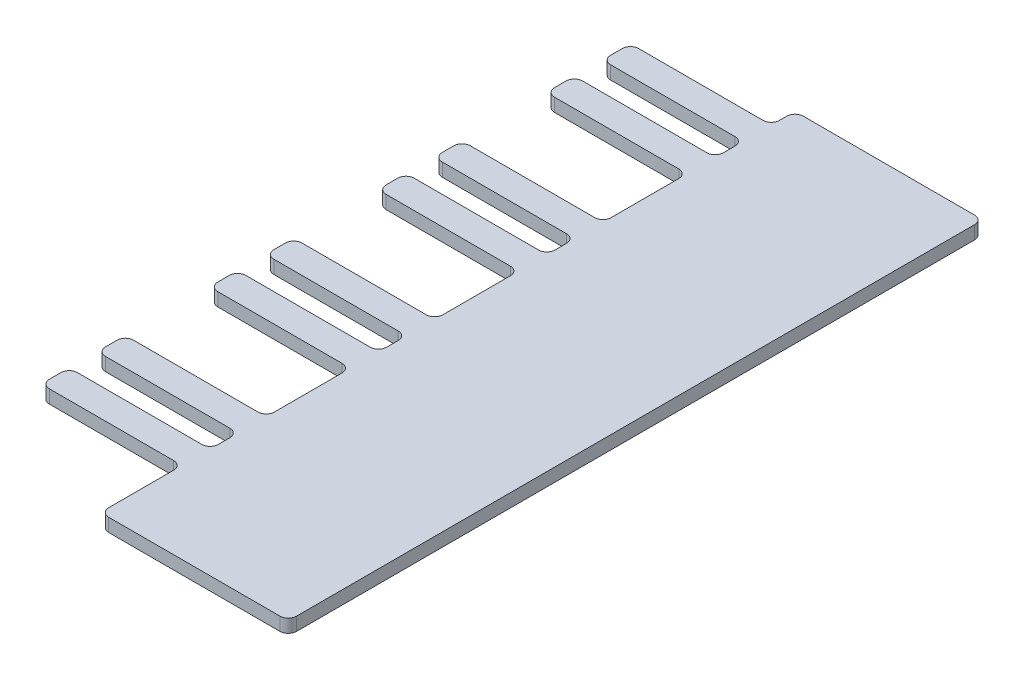
from build123d import *

# Parameters (mm, degrees)
BOSS_EXTRUDE1_DEPTH = 1.2


with BuildPart() as part:
    # Sketch1 → Boss-Extrude1 (new body)
    with BuildSketch(Plane(origin=(0, 0, 0), x_dir=(1, 0, 0), z_dir=(0, 1, 0))):
        with BuildLine():
            Line((-0.75, 7.382), (-12, 7.382))
            ThreePointArc((-12, 7.382), (-12.530330086, 7.601669914), (-12.75, 8.132))
            Line((-12.75, 8.132), (-12.75, 9.172))
            ThreePointArc((-12.75, 9.172), (-12.530330086, 9.702330086), (-12, 9.922))
            Line((-12, 9.922), (-0.75, 9.922))
            ThreePointArc((-0.75, 9.922), (-0.219669914, 10.141669914), (0, 10.672))
            Line((0, 10.672), (0, 11.712))
            ThreePointArc((0, 11.712), (-0.219669914, 12.242330086), (-0.75, 12.462))
            Line((-0.75, 12.462), (-12, 12.462))
            ThreePointArc((-12, 12.462), (-12.530330086, 12.681669914), (-12.75, 13.212))
            Line((-12.75, 13.212), (-12.75, 14.252))
            ThreePointArc((-12.75, 14.252), (-12.530330086, 14.782330086), (-12, 15.002))
            Line((-12, 15.002), (-0.75, 15.002))
            ThreePointArc((-0.75, 15.002), (-0.219669914, 15.221669914), (0, 15.752))
            Line((0, 15.752), (0, 21.872))
            ThreePointArc((0, 21.872), (-0.219669914, 22.402330086), (-0.75, 22.622))
            Line((-0.75, 22.622), (-12, 22.622))
            ThreePointArc((-12, 22.622), (-12.530330086, 22.841669914), (-12.75, 23.372))
            Line((-12.75, 23.372), (-12.75, 24.412))
            ThreePointArc((-12.75, 24.412), (-12.530330086, 24.942330086), (-12, 25.162))
            Line((-12, 25.162), (-0.75, 25.162))
            ThreePointArc((-0.75, 25.162), (-0.219669914, 25.381669914), (0, 25.912))
            Line((0, 25.912), (0, 26.952))
            ThreePointArc((0, 26.952), (-0.219669914, 27.482330086), (-0.75, 27.702))
            Line((-0.75, 27.702), (-12, 27.702))
            ThreePointArc((-12, 27.702), (-12.530330086, 27.921669914), (-12.75, 28.452))
            Line((-12.75, 28.452), (-12.75, 29.492))
            ThreePointArc((-12.75, 29.492), (-12.530330086, 30.022330086), (-12, 30.242))
            Line((-12, 30.242), (-0.75, 30.242))
            ThreePointArc((-0.75, 30.242), (-0.219669914, 30.461669914), (0, 30.992))
            Line((0, 30.992), (0, 37.112))
            ThreePointArc((0, 37.112), (-0.219669914, 37.642330086), (-0.75, 37.862))
            Line((-0.75, 37.862), (-12, 37.862))
            ThreePointArc((-12, 37.862), (-12.530330086, 38.081669914), (-12.75, 38.612))
            Line((-12.75, 38.612), (-12.75, 39.652))
            ThreePointArc((-12.75, 39.652), (-12.530330086, 40.182330086), (-12, 40.402))
            Line((-12, 40.402), (-0.75, 40.402))
            ThreePointArc((-0.75, 40.402), (-0.219669914, 40.621669914), (0, 41.152))
            Line((0, 41.152), (0, 42.192))
            ThreePointArc((0, 42.192), (-0.219669914, 42.722330086), (-0.75, 42.942))
            Line((-0.75, 42.942), (-12, 42.942))
            ThreePointArc((-12, 42.942), (-12.530330086, 43.161669914), (-12.75, 43.692))
            Line((-12.75, 43.692), (-12.75, 44.732))
            ThreePointArc((-12.75, 44.732), (-12.530330086, 45.262330086), (-12, 45.482))
            Line((-12, 45.482), (-0.75, 45.482))
            ThreePointArc((-0.75, 45.482), (-0.219669914, 45.701669914), (0, 46.232))
            Line((0, 46.232), (0, 52.352))
            ThreePointArc((0, 52.352), (-0.219669914, 52.882330086), (-0.75, 53.102))
            Line((-0.75, 53.102), (-12, 53.102))
            ThreePointArc((-12, 53.102), (-12.530330086, 53.321669914), (-12.75, 53.852))
            Line((-12.75, 53.852), (-12.75, 54.892))
            ThreePointArc((-12.75, 54.892), (-12.530330086, 55.422330086), (-12, 55.642))
            Line((-12, 55.642), (-0.75, 55.642))
            ThreePointArc((-0.75, 55.642), (-0.219669914, 55.861669914), (0, 56.392))
            Line((0, 56.392), (0, 57.432))
            ThreePointArc((0, 57.432), (-0.219669914, 57.962330086), (-0.75, 58.182))
            Line((-0.75, 58.182), (-12, 58.182))
            ThreePointArc((-12, 58.182), (-12.530330086, 58.401669914), (-12.75, 58.932))
            Line((-12.75, 58.932), (-12.75, 59.972))
            ThreePointArc((-12.75, 59.972), (-12.530330086, 60.502330086), (-12, 60.722))
            Line((-12, 60.722), (-0.75, 60.722))
            ThreePointArc((-0.75, 60.722), (-0.219669914, 60.941669914), (0, 61.472))
            Line((0, 61.472), (0, 62.122))
            ThreePointArc((0, 62.122), (0.219669914, 62.652330086), (0.75, 62.872))
            Line((0.75, 62.872), (16.25, 62.872))
            ThreePointArc((16.25, 62.872), (16.780330086, 62.652330086), (17, 62.122))
            Line((17, 62.122), (17, 0.75))
            ThreePointArc((17, 0.75), (16.780330086, 0.219669914), (16.25, 0))
            Line((16.25, 0), (0.75, 0))
            ThreePointArc((0.75, 0), (0.219669914, 0.219669914), (0, 0.75))
            Line((0, 0.75), (0, 6.632))
            ThreePointArc((0, 6.632), (-0.219669914, 7.162330086), (-0.75, 7.382))
        make_face()
    extrude(amount=BOSS_EXTRUDE1_DEPTH)


solid = part.part
